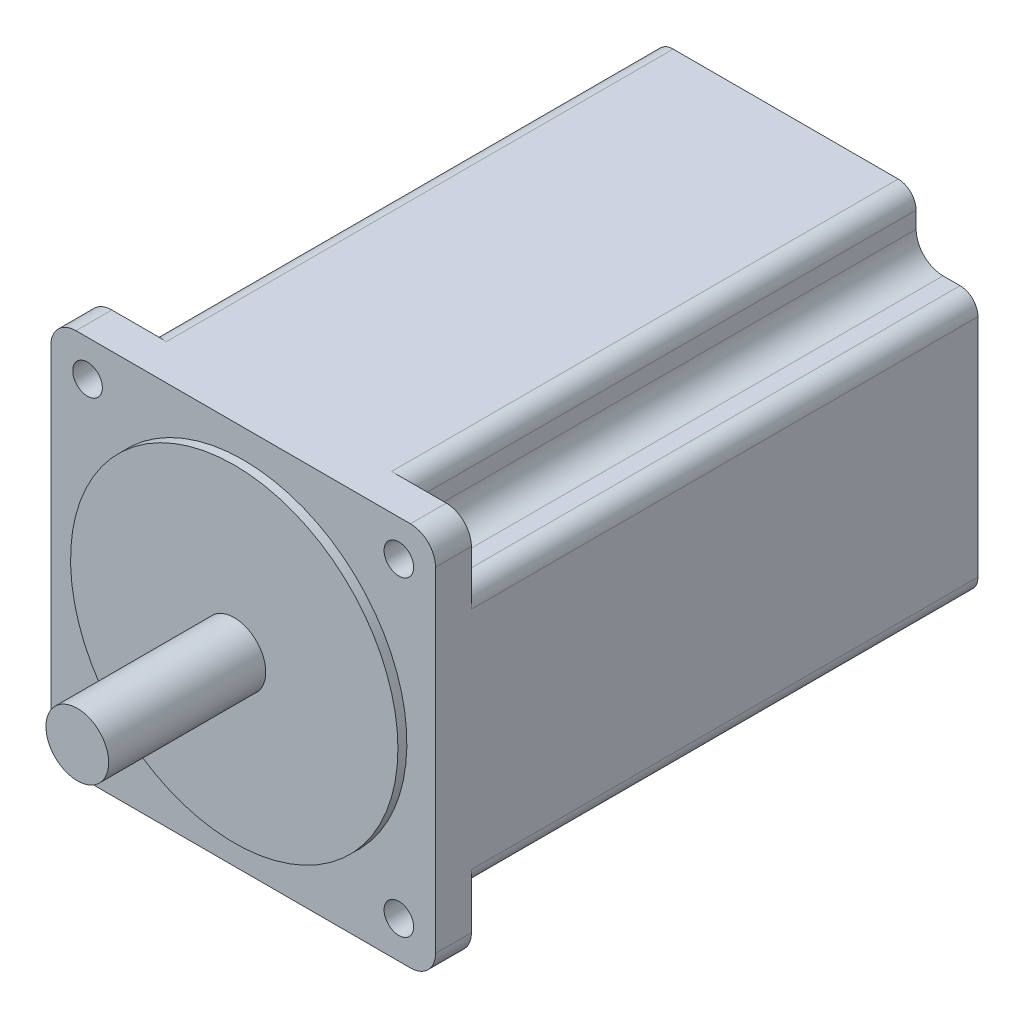
from build123d import *

# Parameters (mm, degrees)
SZKIC7_W                    = 21.6
SZKIC7_H                    = 21.6
DODANIE_WYCI_GNI_CIE5_DEPTH = 12
SZKIC8_W                    = 85.8
SZKIC8_H                    = 115
DODANIE_WYCI_GNI_CIE6_DEPTH = 85.8
SZKIC9_W                    = 85.8
SZKIC9_H                    = 78.988293657
DODANIE_WYCI_GNI_CIE7_DEPTH = 7
SZKIC10_W                   = 113
SZKIC10_H                   = 16.646355961
WYTNIJ_WYCI_GNI_CIE3_DEPTH  = 13.8
SZKIC11_W                   = 13.8
SZKIC11_H                   = 113
WYTNIJ_WYCI_GNI_CIE4_DEPTH  = 13.8
SZKIC12_W                   = 113
SZKIC12_H                   = 13.8
WYTNIJ_WYCI_GNI_CIE5_DEPTH  = 13.8
SZKIC13_W                   = 13.8
SZKIC13_H                   = 113
WYTNIJ_WYCI_GNI_CIE6_DEPTH  = 13.8
SZKIC14_R                   = 36.51
DODANIE_WYCI_GNI_CIE8_DEPTH = 2
OTW_R_POD_RUB_M121_D        = 14.05
OTW_R_POD_RUB_M121_DEPTH    = 2
SZKIC17_W                   = 7
SZKIC17_H                   = 37
OTW_R_6_6_6_6_1_D           = 6.6
OTW_R_6_6_6_6_1_DEPTH       = 45
ZAOKR_GLENIE1_R             = 4.000000016
ZAOKR_GLENIE2_R             = 5.6
ZAOKR_GLENIE3_R             = 5.99999999


with BuildPart() as part:
    # Szkic7 → Dodanie-wyciągnięcie5 (new body)
    with BuildSketch(Plane(origin=(0, -55, 0), x_dir=(-1, 0, 0), z_dir=(0, 1, 0))):
        with Locations((0, -104.2)):
            Rectangle(SZKIC7_W, SZKIC7_H)
    extrude(amount=DODANIE_WYCI_GNI_CIE5_DEPTH)

    # Szkic8 → Dodanie-wyciągnięcie6 (add)
    with BuildSketch(Plane(origin=(0, -43, 0), x_dir=(-1, 0, 0), z_dir=(0, 1, 0))):
        with Locations((0, -57.5)):
            Rectangle(SZKIC8_W, SZKIC8_H)
    extrude(amount=DODANIE_WYCI_GNI_CIE6_DEPTH)

    # Szkic9 → Dodanie-wyciągnięcie7 (add)
    with BuildSketch(Plane(origin=(0, 0, -121), x_dir=(-1, 0, 0), z_dir=(0, 0, -1))):
        with Locations((0, 3.305853172)):
            Rectangle(SZKIC9_W, SZKIC9_H)
    extrude(amount=-DODANIE_WYCI_GNI_CIE7_DEPTH)

    # Szkic10 → Wytnij-wyciągnięcie3 (cut)
    with BuildSketch(Plane.ZY.offset(42.9)):
        with Locations((-64.5, -37.423177981)):
            Rectangle(SZKIC10_W, SZKIC10_H)
    extrude(amount=-WYTNIJ_WYCI_GNI_CIE3_DEPTH, mode=Mode.SUBTRACT)

    # Szkic11 → Wytnij-wyciągnięcie4 (cut)
    with BuildSketch(Plane.XZ.offset(43)):
        with Locations((36, -64.5)):
            Rectangle(SZKIC11_W, SZKIC11_H)
    extrude(amount=-WYTNIJ_WYCI_GNI_CIE4_DEPTH, mode=Mode.SUBTRACT)

    # Szkic12 → Wytnij-wyciągnięcie5 (cut)
    with BuildSketch(Plane(origin=(42.9, 0, 0), x_dir=(0, 0, -1), z_dir=(1, 0, 0))):
        with Locations((64.5, 36)):
            Rectangle(SZKIC12_W, SZKIC12_H)
    extrude(amount=-WYTNIJ_WYCI_GNI_CIE5_DEPTH, mode=Mode.SUBTRACT)

    # Szkic13 → Wytnij-wyciągnięcie6 (cut)
    with BuildSketch(Plane(origin=(0, 42.8, 0), x_dir=(-1, 0, 0), z_dir=(0, 1, 0))):
        with Locations((36, -64.5)):
            Rectangle(SZKIC13_W, SZKIC13_H)
    extrude(amount=-WYTNIJ_WYCI_GNI_CIE6_DEPTH, mode=Mode.SUBTRACT)

    # Szkic14 → Dodanie-wyciągnięcie8 (add)
    with BuildSketch(Plane.XY):
        with Locations(Location((0, 0, 0), (0, 0, 90))):
            Circle(SZKIC14_R)
    extrude(amount=DODANIE_WYCI_GNI_CIE8_DEPTH)

    # Otwór pod śrubę M121
    with Locations(Plane.XY.offset(2)):
        with Locations((0, 0)):
            Hole(OTW_R_POD_RUB_M121_D / 2, depth=OTW_R_POD_RUB_M121_DEPTH)

    # Szkic17 → Obrót1 (revolve)
    with BuildSketch(Plane(origin=(0, 0, 0), x_dir=(1, 0, 0), z_dir=(0, 1, 0))):
        with Locations((3.5, -18.5)):
            Rectangle(SZKIC17_W, SZKIC17_H)
    revolve(axis=Axis((0, 0, 0), (0, 0, 1)))

    # Otwór Ø6.6 (6.6)1
    with Locations(Plane(origin=(0, 0, -8), x_dir=(-1, 0, 0), z_dir=(0, 0, -1))):
        with Locations((34.718942956, -34.718942956), (-34.718942956, -34.718942956), (-34.718942956, 34.718942956), (34.718942956, 34.718942956)):
            Hole(OTW_R_6_6_6_6_1_D / 2, depth=OTW_R_6_6_6_6_1_DEPTH)

    # Zaokrąglenie1
    zaokr_glenie1_edges = [part.edges().sort_by_distance(p)[0] for p in [
        (-42.9, 29, -64.5),
        (-29.1, 42.8, -64.5),
        (-29.1, -43, -61.5),
        (-42.9, -29.1, -64.5),
        (29.1, -43, -61.5),
        (42.9, -29.2, -64.5),
        (42.9, 29.1, -64.5),
        (29.1, 42.8, -64.5),
    ]]
    fillet(zaokr_glenie1_edges, radius=ZAOKR_GLENIE1_R)

    # Zaokrąglenie2
    zaokr_glenie2_edges = [part.edges().sort_by_distance(p)[0] for p in [
        (-42.9, 42.8, -4),
        (42.9, -43, -4),
        (42.9, 42.8, -4),
        (-42.9, -43, -4),
    ]]
    fillet(zaokr_glenie2_edges, radius=ZAOKR_GLENIE2_R)

    # Zaokrąglenie3
    zaokr_glenie3_edges = [part.edges().sort_by_distance(p)[0] for p in [
        (-29.1, 29, -64.5),
        (-29.1, -29.1, -64.5),
        (29.1, -29.2, -64.5),
        (29.1, 29.1, -64.5),
    ]]
    fillet(zaokr_glenie3_edges, radius=ZAOKR_GLENIE3_R)


solid = part.part
